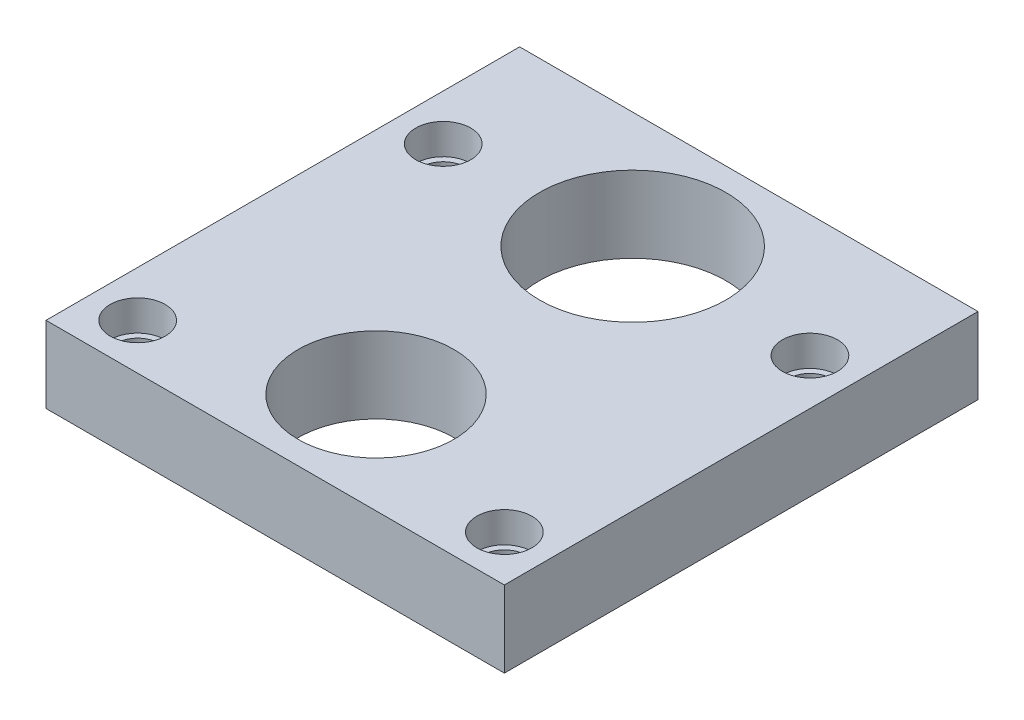
from build123d import *

# Parameters (mm, degrees)
SKETCH_1_W          = 15
SKETCH_1_H          = 15.5
SKETCH_1_R          = 2.55
SKETCH_1_R_2        = 3.05
EXTRUDE_1_DEPTH     = 2.5
CUT_EXTRUDE_START   = 2.5
SKETCH_1_4_R        = 0.9
CUT_EXTRUDE_2_DEPTH = 1
SKETCH_1_5_R        = 0.7
CUT_EXTRUDE_3_DEPTH = 14.747221879


with BuildPart() as part:
    # 草图1 → 凸台-拉伸1 (new body)
    with BuildSketch(Plane(origin=(0, 0, 0), x_dir=(1, 0, 0), z_dir=(0, 1, 0))):
        with Locations((0, -0.25)):
            Rectangle(SKETCH_1_W, SKETCH_1_H)
        with Locations(Location((0, -4.7, 0), (0, 0, 270))):
            Circle(SKETCH_1_R, mode=Mode.SUBTRACT)
        with Locations(Location((0, 3.7, 0), (0, 0, 270))):
            Circle(SKETCH_1_R_2, mode=Mode.SUBTRACT)
    extrude(amount=EXTRUDE_1_DEPTH)

    # 草图1<4> → 切除-拉伸2 (cut)
    with BuildSketch(Plane(origin=(0, 0, 0), x_dir=(1, 0, 0), z_dir=(0, 1, 0)).offset(CUT_EXTRUDE_START)):
        with Locations(Location((-6, -6.5, 0), (0, 0, 90))):
            Circle(SKETCH_1_4_R)
        with Locations(Location((6, 3.5, 0), (0, 0, 90))):
            Circle(SKETCH_1_4_R)
        with Locations(Location((-6, 3.5, 0), (0, 0, 90))):
            Circle(SKETCH_1_4_R)
        with Locations(Location((6, -6.5, 0), (0, 0, 90))):
            Circle(SKETCH_1_4_R)
    extrude(amount=-CUT_EXTRUDE_2_DEPTH, mode=Mode.SUBTRACT)

    # 草图1<5> → 切除-拉伸3 (cut, through all)
    with BuildSketch(Plane(origin=(0, 0, 0), x_dir=(1, 0, 0), z_dir=(0, 1, 0)).offset(CUT_EXTRUDE_START)):
        with Locations(Location((-6, -6.5, 0), (0, 0, 90))):
            Circle(SKETCH_1_5_R)
        with Locations(Location((6, 3.5, 0), (0, 0, 90))):
            Circle(SKETCH_1_5_R)
        with Locations(Location((-6, 3.5, 0), (0, 0, 90))):
            Circle(SKETCH_1_5_R)
        with Locations(Location((6, -6.5, 0), (0, 0, 90))):
            Circle(SKETCH_1_5_R)
    extrude(amount=-CUT_EXTRUDE_3_DEPTH, mode=Mode.SUBTRACT)


solid = part.part
